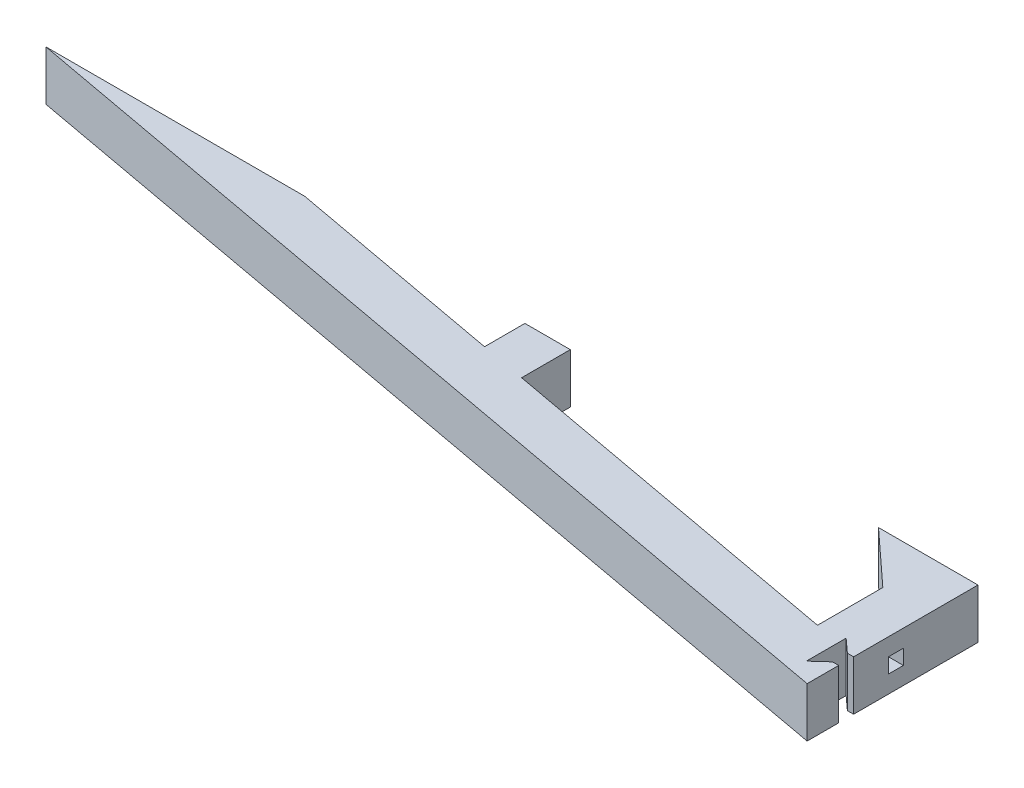
from build123d import *

# Parameters (mm, degrees)
P_IDAT_VYSUNUT_M1_DEPTH  = 8
ODEBRAT_VYSUNUT_M1_DEPTH = 153.557332159
SKICA5_W                 = 16
SKICA5_H                 = 8
P_IDAT_VYSUNUT_M2_DEPTH  = 8
ODEBRAT_VYSUNUT_M4_DEPTH = 153.557332159
SKICA4_W                 = 2.4
SKICA4_H                 = 2.4
ODEBRAT_VYSUNUT_M2_DEPTH = 4.4
SKICA9_R                 = 2.2
ODEBRAT_VYSUNUT_M5_DEPTH = 9.4


with BuildPart() as part:
    # Skica2 → Přidat vysunutím1 (new body)
    with BuildSketch(Plane(origin=(0, 0, 0), x_dir=(1, 0, 0), z_dir=(0, 1, 0))):
        Polygon((0, 0), (0, -27.47211487), (-149.85, 0.000769495), (-108.259653873, 0.000769495), (-72.85, -6.491091207), (-72.85, 0), (-65.55, 0), (-65.55, -7.829443265), (-7.3, -18.508759343), (-7.3, 0), align=None)
    extrude(amount=P_IDAT_VYSUNUT_M1_DEPTH)

    # Skica3 → Odebrat vysunutím1 (cut, through all)
    with BuildSketch(Plane(origin=(0, 8, 0), x_dir=(1, 0, 0), z_dir=(0, 1, 0))):
        Polygon((0, -20), (-1, -20), (-3.2, -18), (-3.2, -24.4), (-1, -22.4), (0, -22.4), align=None)
    extrude(amount=-ODEBRAT_VYSUNUT_M1_DEPTH, mode=Mode.SUBTRACT)

    # Skica5 → Přidat vysunutím2 (add)
    with BuildSketch(Plane(origin=(0, 8, 0), x_dir=(1, 0, 0), z_dir=(0, 1, 0))):
        with Locations((-8, -4)):
            Rectangle(SKICA5_W, SKICA5_H)
    extrude(amount=-P_IDAT_VYSUNUT_M2_DEPTH)

    # Skica7 → Odebrat vysunutím4 (cut, through all)
    with BuildSketch(Plane.XZ):
        Polygon((-7.3, 8), (-16, 8), (-16, 0), align=None)
    extrude(amount=-ODEBRAT_VYSUNUT_M4_DEPTH, mode=Mode.SUBTRACT)

    # Skica4 → Odebrat vysunutím2 (cut)
    with BuildSketch(Plane(origin=(0, 0, 0), x_dir=(0, 0, -1), z_dir=(1, 0, 0))):
        with Locations((-13.2, 4)):
            Rectangle(SKICA4_W, SKICA4_H)
    extrude(amount=-ODEBRAT_VYSUNUT_M2_DEPTH, mode=Mode.SUBTRACT)

    # Skica9 → Odebrat vysunutím5 (cut)
    with BuildSketch(Plane(origin=(0, 0, 0), x_dir=(-1, 0, 0), z_dir=(0, 0, -1))):
        with Locations((3.65, 4)):
            Circle(SKICA9_R)
        with Locations((69.2, 4)):
            Circle(SKICA9_R)
    extrude(amount=-ODEBRAT_VYSUNUT_M5_DEPTH, mode=Mode.SUBTRACT)


solid = part.part
